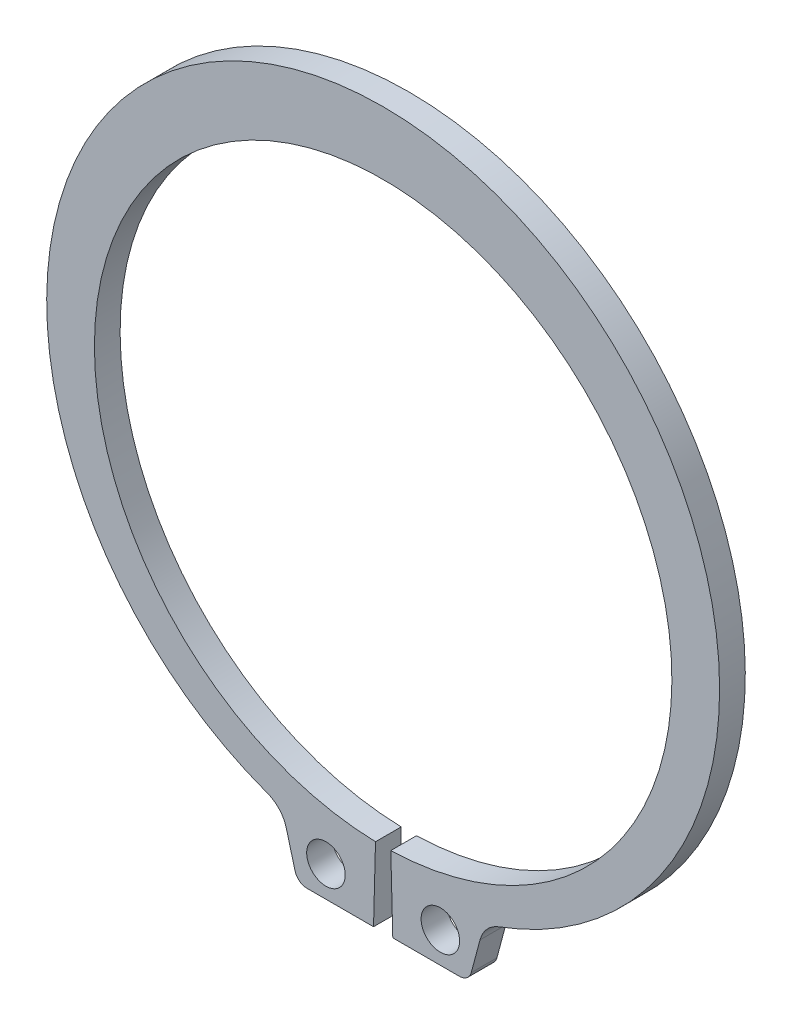
from build123d import *

# Parameters (mm, degrees)
SKETCH1_R           = 0.8001
BOSS_EXTRUDE1_DEPTH = 1.0668


with BuildPart() as part:
    # Sketch1 → Boss-Extrude1 (new body)
    with BuildSketch(Plane.XY):
        with BuildLine():
            Line((3.16619789, -15.718395078), (0.399594472, -15.718395078))
            Line((0.399594472, -15.718395078), (0.3175, -12.619595078))
            ThreePointArc((0.3175, -12.619595078), (0, 11.3538), (-0.3175, -12.619595078))
            Line((-0.3175, -12.619595078), (-0.399594472, -15.718395078))
            Line((-0.399594472, -15.718395078), (-3.16619789, -15.718395078))
            ThreePointArc((-3.16619789, -15.718395078), (-3.475448696, -15.613418575), (-3.65688821, -15.341875153))
            Line((-3.65688821, -15.341875153), (-4.02209585, -13.978901683))
            ThreePointArc((-4.02209585, -13.978901683), (-4.311388241, -13.450794656), (-4.811419846, -13.115301715))
            ThreePointArc((-4.811419846, -13.115301715), (0, 13.97), (4.811419846, -13.115301715))
            ThreePointArc((4.811419846, -13.115301715), (4.311388241, -13.450794656), (4.02209585, -13.978901683))
            Line((4.02209585, -13.978901683), (3.65688821, -15.341875153))
            ThreePointArc((3.65688821, -15.341875153), (3.475448696, -15.613418575), (3.16619789, -15.718395078))
        make_face()
        with Locations((-2.3749, -14.448395078)):
            Circle(SKETCH1_R, mode=Mode.SUBTRACT)
        with Locations((2.3749, -14.448395078)):
            Circle(SKETCH1_R, mode=Mode.SUBTRACT)
    extrude(amount=BOSS_EXTRUDE1_DEPTH)


solid = part.part
